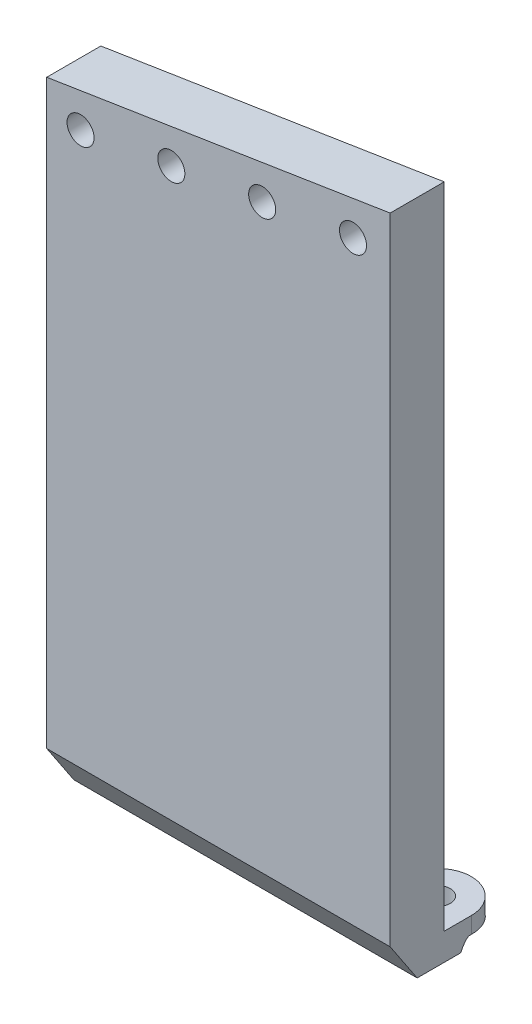
from build123d import *

# Parameters (mm, degrees)
SKETCH1_R               = 1.2065
BOSS_EXTRUDE1_DEPTH     = 2.54
SKETCH2_W               = 32.258
SKETCH2_H               = 5.08
BOSS_EXTRUDE2_DEPTH     = 60.96
CUT_EXTRUDE2_DEPTH      = 5.08
SKETCH3_R               = 1.27
CUT_EXTRUDE1_DEPTH      = 5.08
CUT_EXTRUDE3_DEPTH      = 32.258
SKETCH6_R               = 3.21939192
CUT_EXTRUDE4_DEPTH      = 2.54
SKETCH7_R               = 3.216046402
CUT_EXTRUDE5_DEPTH      = 2.54
CUT_EXTRUDE7_DEPTH      = 91.704054458
CUT_EXTRUDE7_DEPTH_BACK = 91.704054458
SKETCH8_W               = 34.637942207
SKETCH8_H               = 68.994690033
CUT_EXTRUDE9_DEPTH      = 91.704054458
CUT_EXTRUDE9_DEPTH_BACK = 91.704054458
SKETCH9_W               = 38.908401684
SKETCH9_H               = 71.01922277


with BuildPart() as part:
    # Sketch1 → Boss-Extrude1 (new body)
    with BuildSketch(Plane(origin=(0, 0, 0), x_dir=(1, 0, 0), z_dir=(0, 1, 0))):
        with BuildLine():
            Line((0, 0), (32.258, 0))
            Line((32.258, 0), (32.258, 7.62))
            ThreePointArc((32.258, 7.62), (29.083, 10.795), (25.908, 7.62))
            Line((25.908, 7.62), (6.35, 7.62))
            ThreePointArc((6.35, 7.62), (3.175, 10.795), (0, 7.62))
            Line((0, 7.62), (0, 0))
        make_face()
        with Locations(Location((3.175, 7.62, 0), (0, 0, 270))):
            Circle(SKETCH1_R, mode=Mode.SUBTRACT)
        with Locations(Location((29.083, 7.62, 0), (0, 0, 270))):
            Circle(SKETCH1_R, mode=Mode.SUBTRACT)
    extrude(amount=BOSS_EXTRUDE1_DEPTH)

    # Sketch2 → Boss-Extrude2 (add)
    with BuildSketch(Plane(origin=(0, 2.54, 0), x_dir=(1, 0, 0), z_dir=(0, 1, 0))):
        with Locations((16.129, 2.54)):
            Rectangle(SKETCH2_W, SKETCH2_H)
    extrude(amount=BOSS_EXTRUDE2_DEPTH)

    # Sketch4 → Cut-Extrude2 (cut)
    with BuildSketch(Plane.XY):
        Polygon((32.258, 63.5), (0, 58.42), (0, 63.5), align=None)
    extrude(amount=-CUT_EXTRUDE2_DEPTH, mode=Mode.SUBTRACT)

    # Sketch3 → Cut-Extrude1 (cut)
    with BuildSketch(Plane(origin=(0, 0, -5.08), x_dir=(-1, 0, 0), z_dir=(0, 0, -1))):
        with Locations((-28.767594731, 59.736200914)):
            Circle(SKETCH3_R)
        with Locations((-20.236729821, 58.392757622)):
            Circle(SKETCH3_R)
        with Locations((-11.70586491, 57.049314329)):
            Circle(SKETCH3_R)
        with Locations((-3.175, 55.705871036)):
            Circle(SKETCH3_R)
    extrude(amount=-CUT_EXTRUDE1_DEPTH, mode=Mode.SUBTRACT)

    # Sketch5 → Cut-Extrude3 (cut)
    with BuildSketch(Plane.ZY):
        Polygon((0, 0), (-2.54, 0), (0, 3.81), align=None)
    extrude(amount=-CUT_EXTRUDE3_DEPTH, mode=Mode.SUBTRACT)

    # Sketch6 → Cut-Extrude4 (cut)
    with BuildSketch(Plane(origin=(0.626970779, -3.981264444, 0), x_dir=(0.9878259507117183, 0.1555631418443651, 0), z_dir=(-0.15556314184436507, 0.9878259507117182, 0))):
        with Locations((28.811866038, 7.647867292)):
            Circle(SKETCH6_R)
    extrude(amount=-CUT_EXTRUDE4_DEPTH, mode=Mode.SUBTRACT)

    # Sketch7 → Cut-Extrude5 (cut)
    with BuildSketch(Plane(origin=(0, 0, 0), x_dir=(0.9878259507117183, 0.1555631418443651, 0), z_dir=(-0.15556314184436507, 0.9878259507117182, 0))):
        with Locations((3.216043813, 7.615918666)):
            Circle(SKETCH7_R)
    extrude(amount=-CUT_EXTRUDE5_DEPTH, mode=Mode.SUBTRACT)

    # Mirror1: part across plane


with BuildPart() as part_1:
    add(part.part)
    add(part.part.mirror(Plane(origin=(32.258, 2.54, 0), x_dir=(0, 0, 1), z_dir=(-1, 0, 0))))

    # Sketch8 → Cut-Extrude7 (cut, two sides: drawn at the far end of the back side and taken through both)
    with BuildSketch(Plane(origin=(0, 0, -5.08), x_dir=(-1, 0, 0), z_dir=(0, 0, -1)).offset(-CUT_EXTRUDE7_DEPTH_BACK)):
        with Locations((-14.939028897, 29.002654984)):
            Rectangle(SKETCH8_W, SKETCH8_H)
    extrude(amount=CUT_EXTRUDE7_DEPTH + CUT_EXTRUDE7_DEPTH_BACK, mode=Mode.SUBTRACT)

    # Mirror2: part across plane


with BuildPart() as part_2:
    add(part_1.part)
    add(part_1.part.mirror(Plane(origin=(32.258, 63.5, 0), x_dir=(0, 0, 1), z_dir=(1, 0, 0))))

    # Sketch9 → Cut-Extrude9 (cut, two sides: drawn at the far end of the back side and taken through both)
    with BuildSketch(Plane(origin=(0, 0, -5.08), x_dir=(-1, 0, 0), z_dir=(0, 0, -1)).offset(-CUT_EXTRUDE9_DEPTH_BACK)):
        with Locations((-51.712200842, 27.990388615)):
            Rectangle(SKETCH9_W, SKETCH9_H)
    extrude(amount=CUT_EXTRUDE9_DEPTH + CUT_EXTRUDE9_DEPTH_BACK, mode=Mode.SUBTRACT)


solid = part_2.part
